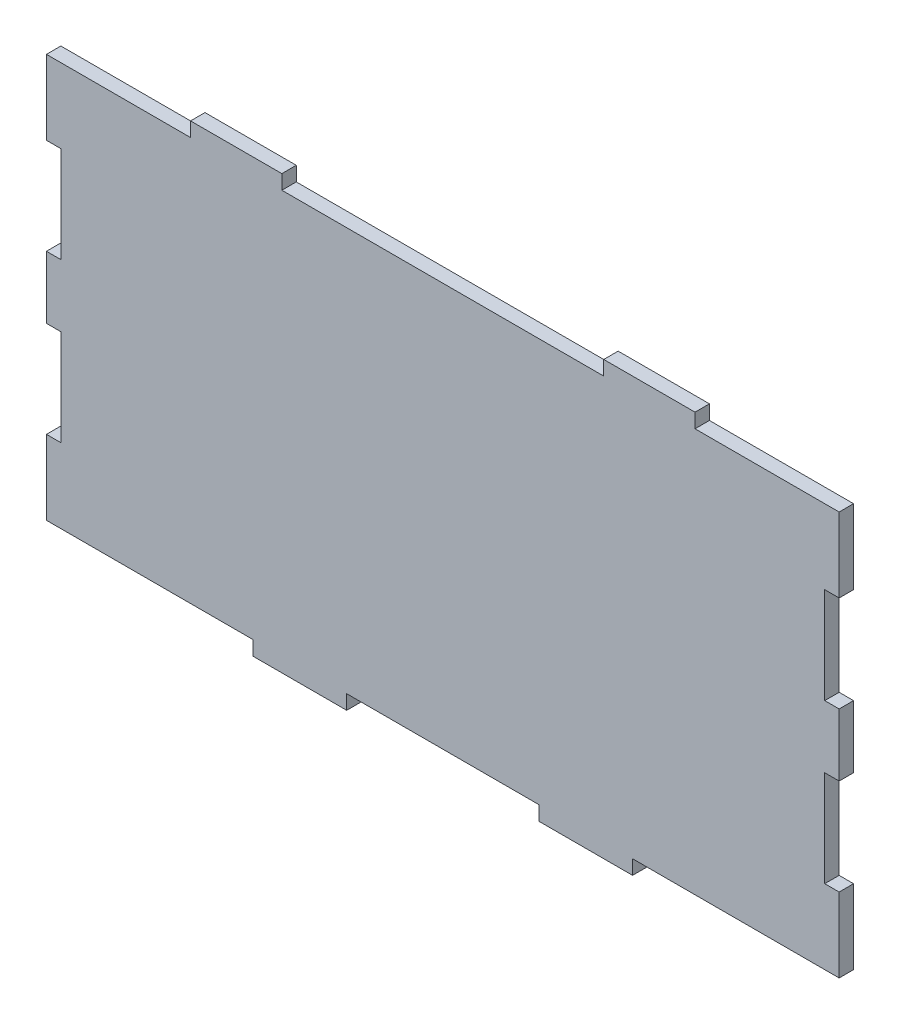
from build123d import *

# Parameters (mm, degrees)
ESQUISSE1_W             = 330
ESQUISSE1_H             = 180
BOSS_EXTRU_1_DEPTH      = 6
ESQUISSE2_W             = 60
ESQUISSE2_H             = 6
ESQUISSE2_W_2           = 134
ESQUISSE2_W_3           = 6
ESQUISSE2_H_2           = 40
ESQUISSE2_W_4           = 86
ESQUISSE2_W_5           = 80
ENL_V_MAT_ENCOCHE_DEPTH = 376.946804748


with BuildPart() as part:
    # Esquisse1 → Boss.-Extru.1 (new body)
    with BuildSketch(Plane.XY):
        with Locations((-165, 90)):
            Rectangle(ESQUISSE1_W, ESQUISSE1_H)
    extrude(amount=BOSS_EXTRU_1_DEPTH)

    # Esquisse2 → Enlèv. mat encoche (cut, through all)
    with BuildSketch(Plane.XY.offset(6)):
        with Locations((-300, 177)):
            Rectangle(ESQUISSE2_W, ESQUISSE2_H)
        with Locations((-165, 177)):
            Rectangle(ESQUISSE2_W_2, ESQUISSE2_H)
        with Locations((-30, 177)):
            Rectangle(ESQUISSE2_W, ESQUISSE2_H)
        with Locations((-327, 123)):
            Rectangle(ESQUISSE2_W_3, ESQUISSE2_H_2)
        with Locations((-327, 57)):
            Rectangle(ESQUISSE2_W_3, ESQUISSE2_H_2)
        with Locations((-3, 123)):
            Rectangle(ESQUISSE2_W_3, ESQUISSE2_H_2)
        with Locations((-3, 57)):
            Rectangle(ESQUISSE2_W_3, ESQUISSE2_H_2)
        with Locations((-287, 3)):
            Rectangle(ESQUISSE2_W_4, ESQUISSE2_H)
        with Locations((-165, 3)):
            Rectangle(ESQUISSE2_W_5, ESQUISSE2_H)
        with Locations((-43, 3)):
            Rectangle(ESQUISSE2_W_4, ESQUISSE2_H)
    extrude(amount=-ENL_V_MAT_ENCOCHE_DEPTH, mode=Mode.SUBTRACT)


solid = part.part
